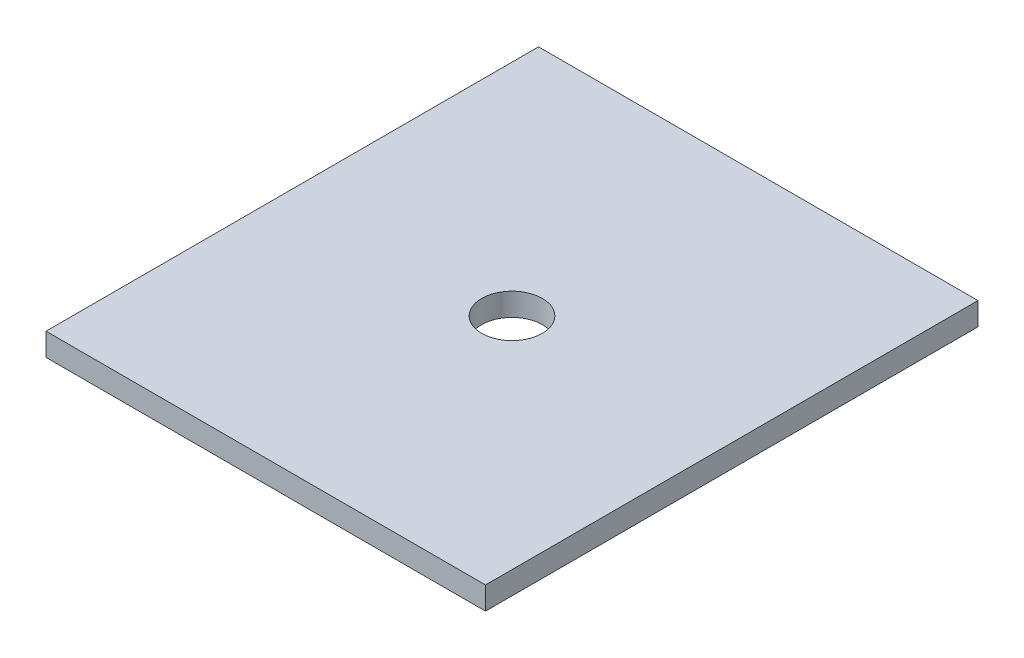
from build123d import *

# Parameters (mm, degrees)
SKETCH4_W           = 57.999956111
SKETCH4_H           = 64.999950815
SKETCH4_R           = 4
BOSS_EXTRUDE1_DEPTH = 3


with BuildPart() as part:
    # Sketch4 → Boss-Extrude1 (new body)
    with BuildSketch(Plane(origin=(0, 0, 0), x_dir=(1, 0, 0), z_dir=(0, 1, 0))):
        with Locations((-2.1945e-05, 2.4592e-05)):
            Rectangle(SKETCH4_W, SKETCH4_H)
        with Locations(Location((0, 0, 0), (0, 0, 270))):
            Circle(SKETCH4_R, mode=Mode.SUBTRACT)
    extrude(amount=BOSS_EXTRUDE1_DEPTH)


solid = part.part
